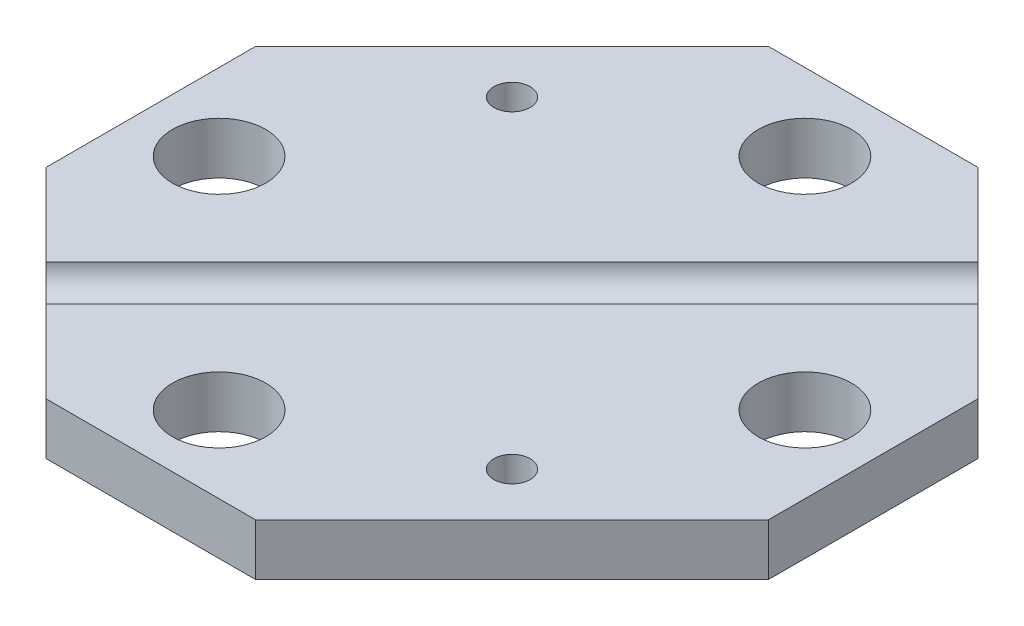
from build123d import *

# Parameters (mm, degrees)
SKETCH1_R           = 4.5
BOSS_EXTRUDE1_DEPTH = 5
CUT_EXTRUDE1_REACH  = 80.329
CUT_EXTRUDE3_REACH  = 59.217
SKETCH6_R           = 1.75
SKETCH8_R           = 15.25
SKETCH8_R_2         = 0.95
CUT_EXTRUDE7_DEPTH  = 0.5


with BuildPart() as part:
    # Sketch1 → Boss-Extrude1 (new body)
    with BuildSketch(Plane(origin=(0, 0, 0), x_dir=(1, 0, 0), z_dir=(0, 1, 0))):
        Polygon((-40.303943114, 15.555205773), (-15.555205773, 40.303943114), (4.694794227, 40.303943114), (24.042773974, 20.955963368), (24.042773974, 0.705963368), (-0.705963368, -24.042773974), (-20.955963368, -24.042773974), (-40.303943114, -4.694794227), align=None)
        with Locations(Location((-11.666118476, -16.618152771, 0), (0, 0, 270))):
            Circle(SKETCH1_R, mode=Mode.SUBTRACT)
        with Locations(Location((16.618152771, 11.666118476, 0), (0, 0, 270))):
            Circle(SKETCH1_R, mode=Mode.SUBTRACT)
        with Locations(Location((-4.595050664, 32.879321912, 0), (0, 0, 270))):
            Circle(SKETCH1_R, mode=Mode.SUBTRACT)
        with Locations(Location((-32.879321912, 4.595050664, 0), (0, 0, 270))):
            Circle(SKETCH1_R, mode=Mode.SUBTRACT)
    extrude(amount=BOSS_EXTRUDE1_DEPTH)

    # Sketch4 → Cut-Extrude1 (cut, up to next)
    with BuildSketch(Plane(origin=(22.499368671, 0, -22.499368671), x_dir=(-0.7071067811865465, 0, -0.7071067811865487), z_dir=(0.7071067811865487, 0, -0.7071067811865465)), mode=Mode.PRIVATE) as cut_extrude1_sk1:
        with BuildLine():
            Line((13.998382969, 5), (8.998382969, 5))
            ThreePointArc((8.998382969, 5), (11.498382969, 2.5), (13.998382969, 5))
        make_face()
    cut_extrude1_tool1 = extrude(cut_extrude1_sk1.sketch, amount=-CUT_EXTRUDE1_REACH, mode=Mode.PRIVATE) & part.part
    add(cut_extrude1_tool1.solids().sort_by_distance((14.368784, 3.938967, -30.629953))[0], mode=Mode.SUBTRACT)

    # Sketch6 → Cut-Extrude3 (cut, up to next)
    with BuildSketch(Plane(origin=(0, 5, 0), x_dir=(1, 0, 0), z_dir=(0, 1, 0)), mode=Mode.PRIVATE) as cut_extrude3_sk1:
        with Locations(Location((-23.686933757, 23.686933757, 0), (0, 0, 270))):
            Circle(SKETCH6_R)
    cut_extrude3_tool1 = extrude(cut_extrude3_sk1.sketch, amount=-CUT_EXTRUDE3_REACH, mode=Mode.PRIVATE) & part.part
    # Sketch6 → Cut-Extrude3 (cut, up to next)
    with BuildSketch(Plane(origin=(0, 5, 0), x_dir=(1, 0, 0), z_dir=(0, 1, 0)), mode=Mode.PRIVATE) as cut_extrude3_sk2:
        with Locations(Location((7.425764616, -7.425764616, 0), (0, 0, 270))):
            Circle(SKETCH6_R)
    cut_extrude3_tool2 = extrude(cut_extrude3_sk2.sketch, amount=-CUT_EXTRUDE3_REACH, mode=Mode.PRIVATE) & part.part
    add(cut_extrude3_tool1.solids().sort_by_distance((-23.686934, 5, -23.686934))[0], mode=Mode.SUBTRACT)
    add(cut_extrude3_tool2.solids().sort_by_distance((7.425765, 5, 7.425765))[0], mode=Mode.SUBTRACT)

    # Sketch8 → Cut-Extrude7 (cut)
    # profile 1 of 3: a face of its own
    with BuildSketch(Plane.XZ):
        with Locations((-8.13058457, -8.13058457)):
            Circle(SKETCH8_R)
    # profile 2 of 3: a face of its own
    with BuildSketch(Plane.XZ):
        with BuildLine():
            Line((-23.156603671, 2.652793843), (-21.615780603, -1.009349568))
            ThreePointArc((-21.615780603, -1.009349568), (-18.913962984, 2.652793843), (-15.251819573, 5.354611462))
            Line((-15.251819573, 5.354611462), (-18.913962984, 6.89543453))
            ThreePointArc((-18.913962984, 6.89543453), (-23.156603671, 6.89543453), (-23.156603671, 2.652793843))
        make_face()
        with Locations(Location((-21.035283327, 4.774114186, 0), (0, 0, 270))):
            Circle(SKETCH8_R_2, mode=Mode.SUBTRACT)
    # profile 3 of 3: a face of its own
    with BuildSketch(Plane.XZ):
        with BuildLine():
            Line((-1.009349568, -21.615780603), (2.652793843, -23.156603671))
            ThreePointArc((2.652793843, -23.156603671), (6.89543453, -23.156603671), (6.89543453, -18.913962984))
            Line((6.89543453, -18.913962984), (5.354611462, -15.251819573))
            ThreePointArc((5.354611462, -15.251819573), (2.652793843, -18.913962984), (-1.009349568, -21.615780603))
        make_face()
        with Locations(Location((4.774114186, -21.035283327, 0), (0, 0, 270))):
            Circle(SKETCH8_R_2, mode=Mode.SUBTRACT)
    extrude(amount=-CUT_EXTRUDE7_DEPTH, mode=Mode.SUBTRACT)


solid = part.part
